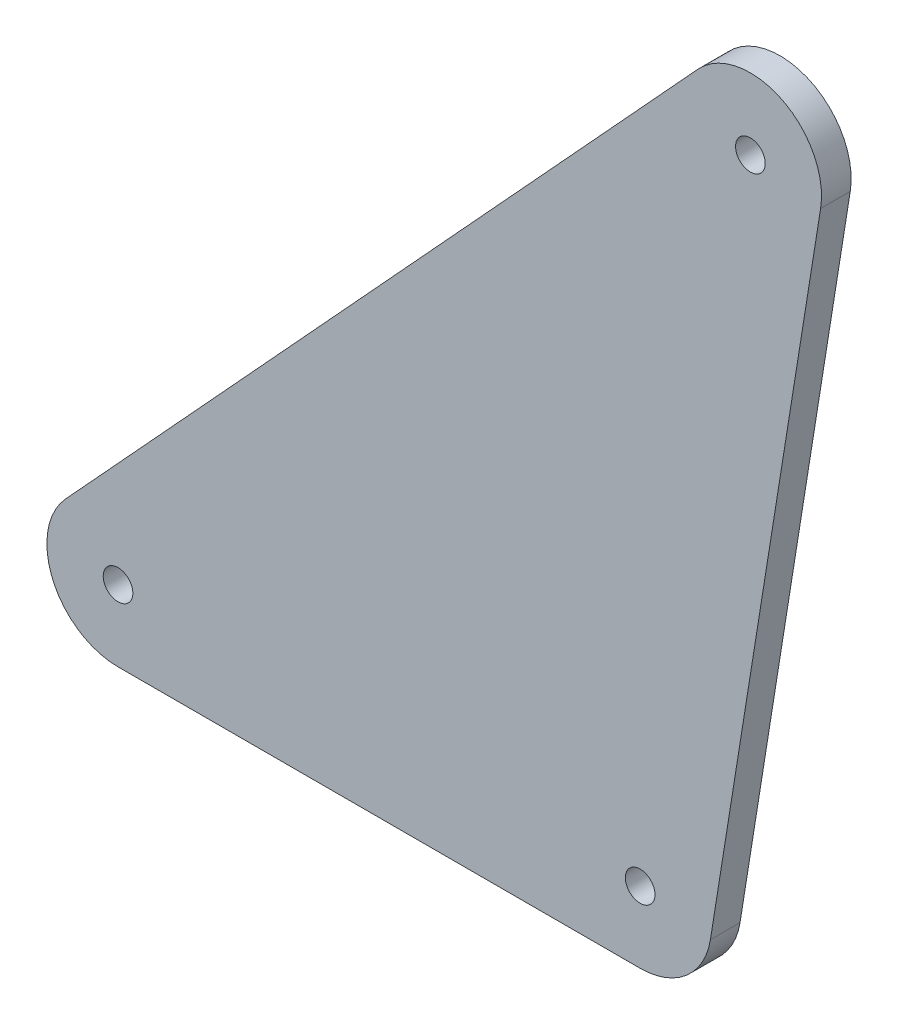
from build123d import *

# Parameters (mm, degrees)
SKETCH_1_R      = 2.5
EXTRUDE_1_DEPTH = 5


with BuildPart() as part:
    # 草图1 → 凸台-拉伸1 (new body)
    with BuildSketch(Plane.XY.offset(5)):
        with BuildLine():
            Line((0, -12), (88.080000003, -12))
            ThreePointArc((88.080000003, -12), (95.86570804, -9.131415574), (99.929089273, -1.897125062))
            Line((99.929089273, -1.897125062), (118.520914886, 114.223949773))
            ThreePointArc((118.520914886, 114.223949773), (111.900976478, 126.921814685), (97.834605309, 124.239174198))
            Line((97.834605309, 124.239174198), (-8.837220307, 8.118099363))
            ThreePointArc((-8.837220307, 8.118099363), (-10.986746388, -4.826116848), (0, -12))
        make_face()
        with Locations(Location((88.080000003, 0, 0), (0, 0, 180))):
            Circle(SKETCH_1_R, mode=Mode.SUBTRACT)
        with Locations(Location((106.671825617, 116.121074836, 0), (0, 0, 180))):
            Circle(SKETCH_1_R, mode=Mode.SUBTRACT)
        with Locations(Location((0, 0, 0), (0, 0, 180))):
            Circle(SKETCH_1_R, mode=Mode.SUBTRACT)
    extrude(amount=-EXTRUDE_1_DEPTH)


solid = part.part
